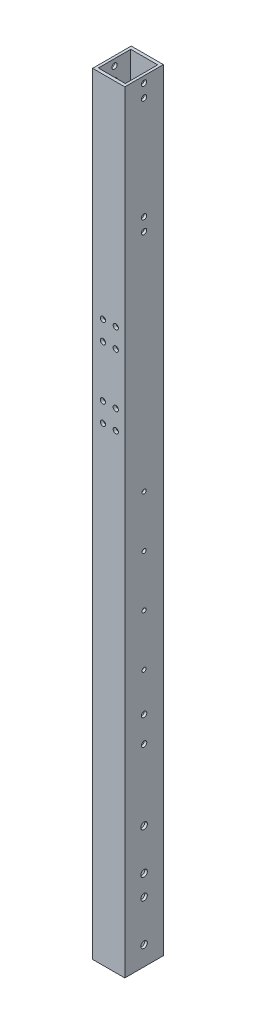
from build123d import *

# Parameters (mm, degrees)
SKETCH_1_W           = 25
SKETCH_1_H           = 30
SKETCH_1_W_2         = 21
SKETCH_1_H_2         = 25.2
EXTRUDE_1_DEPTH      = 600
SKETCH_3_R           = 2.05
SKETCH_3_R_2         = 2.55
CUT_EXTRUDE_2_DEPTH  = 601.707915713
SKETCH_4_R           = 2.05
CUT_EXTRUDE_3_DEPTH  = 601.87956364
SKETCH_6_R           = 2.55
CUT_EXTRUDE_4_DEPTH  = 42
CUT_EXTRUDE_5_REACH  = 602.708
SKETCH_7_R           = 2.1
SKETCH_8_OUTSIDE_W   = 152.254
SKETCH_8_OUTSIDE_H   = 722.254
SKETCH_8_OUTSIDE_W_2 = 30
SKETCH_8_OUTSIDE_H_2 = 600
CUT_EXTRUDE_8_DEPTH  = 5
SKETCH_9_R           = 1.6
CUT_EXTRUDE_9_DEPTH  = 40


with BuildPart() as part:
    # 草图1 → 凸台-拉伸1 (new body)
    with BuildSketch(Plane(origin=(0, 0, 0), x_dir=(1, 0, 0), z_dir=(0, 1, 0))):
        Rectangle(SKETCH_1_W, SKETCH_1_H)
        Rectangle(SKETCH_1_W_2, SKETCH_1_H_2, mode=Mode.SUBTRACT)
    extrude(amount=EXTRUDE_1_DEPTH)

    # 草图3 → 切除-拉伸2 (cut, through all)
    with BuildSketch(Plane.ZY.offset(12.5)):
        with Locations((0, 595)):
            Circle(SKETCH_3_R)
        with Locations(Location((0, 585, 0), (0, 0, 180))):
            Circle(SKETCH_3_R)
        with Locations((0, 505)):
            Circle(SKETCH_3_R)
        with Locations(Location((0, 495, 0), (0, 0, 180))):
            Circle(SKETCH_3_R)
        with Locations((0, 15)):
            Circle(SKETCH_3_R_2)
        with Locations((0, 47)):
            Circle(SKETCH_3_R_2)
    extrude(amount=-CUT_EXTRUDE_2_DEPTH, mode=Mode.SUBTRACT)

    # 草图4 → 切除-拉伸3 (cut, through all)
    with BuildSketch(Plane.XY.offset(15)):
        with Locations((5.5, 435)):
            Circle(SKETCH_4_R)
        with Locations((-4.5, 435)):
            Circle(SKETCH_4_R)
        with Locations((-4.5, 420)):
            Circle(SKETCH_4_R)
        with Locations((5.5, 420)):
            Circle(SKETCH_4_R)
        with Locations(Location((-4.5, 380, 0), (0, 0, 180))):
            Circle(SKETCH_4_R)
        with Locations(Location((-4.5, 365, 0), (0, 0, 180))):
            Circle(SKETCH_4_R)
        with Locations(Location((5.5, 365, 0), (0, 0, 180))):
            Circle(SKETCH_4_R)
        with Locations(Location((5.5, 380, 0), (0, 0, 180))):
            Circle(SKETCH_4_R)
    extrude(amount=-CUT_EXTRUDE_3_DEPTH, mode=Mode.SUBTRACT)

    # 草图6 → 切除-拉伸4 (cut)
    with BuildSketch(Plane.ZY.offset(12.5)):
        with Locations((0, 63)):
            Circle(SKETCH_6_R)
        with Locations((0, 95)):
            Circle(SKETCH_6_R)
    extrude(amount=-CUT_EXTRUDE_4_DEPTH, mode=Mode.SUBTRACT)

    # 草图7 → 切除-拉伸5 (cut, up to next)
    with BuildSketch(Plane(origin=(12.5, 0, 0), x_dir=(0, 0, -1), z_dir=(1, 0, 0)), mode=Mode.PRIVATE) as cut_extrude_5_sk1:
        with Locations((0, 150)):
            Circle(SKETCH_7_R)
    cut_extrude_5_tool1 = extrude(cut_extrude_5_sk1.sketch, amount=-CUT_EXTRUDE_5_REACH, mode=Mode.PRIVATE) & part.part
    # 草图7 → 切除-拉伸5 (cut, up to next)
    with BuildSketch(Plane(origin=(12.5, 0, 0), x_dir=(0, 0, -1), z_dir=(1, 0, 0)), mode=Mode.PRIVATE) as cut_extrude_5_sk2:
        with Locations((0, 170)):
            Circle(SKETCH_7_R)
    cut_extrude_5_tool2 = extrude(cut_extrude_5_sk2.sketch, amount=-CUT_EXTRUDE_5_REACH, mode=Mode.PRIVATE) & part.part
    add(cut_extrude_5_tool1.solids().sort_by_distance((12.5, 150, 0))[0], mode=Mode.SUBTRACT)
    add(cut_extrude_5_tool2.solids().sort_by_distance((12.5, 170, 0))[0], mode=Mode.SUBTRACT)

    # 草图8 outside → 切除-拉伸8 (cut)
    # profile 1 of 2: a face of its own
    with BuildSketch(Plane.ZY.offset(12.5)):
        with Locations((0, 300)):
            Rectangle(SKETCH_8_OUTSIDE_W, SKETCH_8_OUTSIDE_H)
        with Locations((0, 300)):
            Rectangle(SKETCH_8_OUTSIDE_W_2, SKETCH_8_OUTSIDE_H_2, mode=Mode.SUBTRACT)
    # profile 2 of 2: a face of its own
    with BuildSketch(Plane.ZY.offset(12.5)):
        with BuildLine():
            Line((5, 175), (5, 145))
            ThreePointArc((5, 145), (0, 140), (-5, 145))
            Line((-5, 145), (-5, 175))
            ThreePointArc((-5, 175), (0, 180), (5, 175))
        make_face()
    extrude(amount=-CUT_EXTRUDE_8_DEPTH, mode=Mode.SUBTRACT)

    # 草图9 → 切除-拉伸9 (cut)
    with BuildSketch(Plane.ZY.offset(12.5)):
        with Locations((0, 320)):
            Circle(SKETCH_9_R)
        with Locations((0, 280)):
            Circle(SKETCH_9_R)
        with Locations((0, 240)):
            Circle(SKETCH_9_R)
        with Locations((0, 200)):
            Circle(SKETCH_9_R)
    extrude(amount=-CUT_EXTRUDE_9_DEPTH, mode=Mode.SUBTRACT)


solid = part.part
